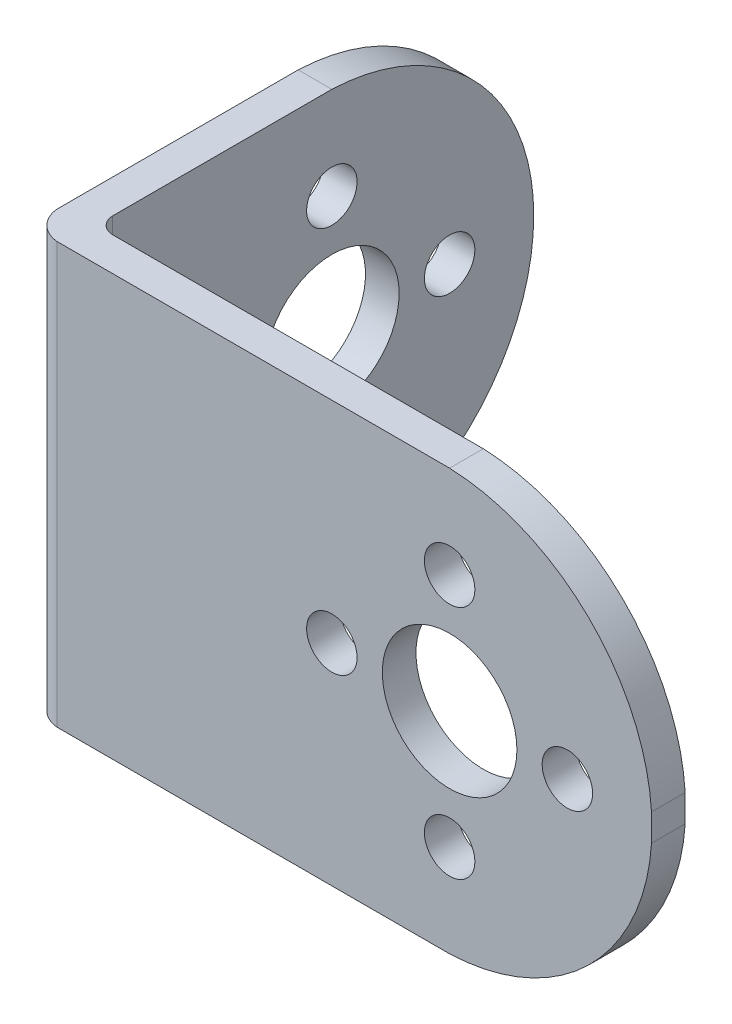
from build123d import *

# Parameters (mm, degrees)
BOSS_EXTRUDE1_DEPTH = 25
CUT_EXTRUDE1_DEPTH  = 25
CUT_EXTRUDE2_DEPTH  = 25
SKETCH5_R           = 4
SKETCH5_R_2         = 1.5
CUT_EXTRUDE3_DEPTH  = 25
SKETCH6_R           = 4
SKETCH6_R_2         = 1.5
CUT_EXTRUDE4_DEPTH  = 25


with BuildPart() as part:
    # Sketch1 → Boss-Extrude1 (new body)
    with BuildSketch(Plane(origin=(0, 0, 0), x_dir=(1, 0, 0), z_dir=(0, 1, 0))):
        with BuildLine():
            ThreePointArc((0, 1.659075407), (0.530256055, 0.530256055), (1.659075407, 0))
            Line((1.659075407, 0), (2, 0))
            Line((2, 0), (37, 0))
            Line((37, 0), (37, 2))
            Line((37, 2), (3.038729714, 2))
            ThreePointArc((3.038729714, 2), (3.003147911, 1.999369152), (2.967566108, 2))
            ThreePointArc((2.967566108, 2), (2.293369144, 2.293369144), (2, 2.967566108))
            Line((2, 2.967566108), (2, 28))
            Line((2, 28), (0, 28))
            Line((0, 28), (0, 2))
            Line((0, 2), (0, 1.659075407))
        make_face()
    extrude(amount=BOSS_EXTRUDE1_DEPTH)

    # Sketch2 → Cut-Extrude1 (cut)
    with BuildSketch(Plane.ZY):
        with BuildLine():
            ThreePointArc((-28, 12.5), (-24.514439297, 21.163861726), (-16, 25))
            Line((-16, 25), (-28, 25))
            Line((-28, 25), (-28, 12.5))
        make_face()
        with BuildLine():
            ThreePointArc((-16, 0), (-24.514439297, 3.836138274), (-28, 12.5))
            Line((-28, 12.5), (-28, 0))
            Line((-28, 0), (-16, 0))
        make_face()
    extrude(amount=-CUT_EXTRUDE1_DEPTH, mode=Mode.SUBTRACT)

    # Sketch4 → Cut-Extrude2 (cut)
    with BuildSketch(Plane.XY):
        with BuildLine():
            Line((37, 25), (25, 25))
            ThreePointArc((25, 25), (33.247279652, 21.458751494), (37, 13.305521912))
            Line((37, 13.305521912), (37, 25))
        make_face()
        with BuildLine():
            Line((37, 0), (37, 11.694478088))
            ThreePointArc((37, 11.694478088), (33.247279652, 3.541248506), (25, 0))
            Line((25, 0), (37, 0))
        make_face()
    extrude(amount=-CUT_EXTRUDE2_DEPTH, mode=Mode.SUBTRACT)

    # Sketch5 → Cut-Extrude3 (cut)
    with BuildSketch(Plane.XY):
        with Locations((25, 12.5)):
            Circle(SKETCH5_R)
        with Locations((25, 19.5)):
            Circle(SKETCH5_R_2)
        with Locations((32, 12.5)):
            Circle(SKETCH5_R_2)
        with Locations((25, 5.5)):
            Circle(SKETCH5_R_2)
        with Locations((18, 12.5)):
            Circle(SKETCH5_R_2)
    extrude(amount=-CUT_EXTRUDE3_DEPTH, mode=Mode.SUBTRACT)

    # Sketch6 → Cut-Extrude4 (cut)
    with BuildSketch(Plane.ZY):
        with Locations((-16, 12.5)):
            Circle(SKETCH6_R)
        with Locations((-16, 5.5)):
            Circle(SKETCH6_R_2)
        with Locations((-23, 12.5)):
            Circle(SKETCH6_R_2)
        with Locations((-16, 19.5)):
            Circle(SKETCH6_R_2)
        with Locations((-9, 12.5)):
            Circle(SKETCH6_R_2)
    extrude(amount=-CUT_EXTRUDE4_DEPTH, mode=Mode.SUBTRACT)


solid = part.part
